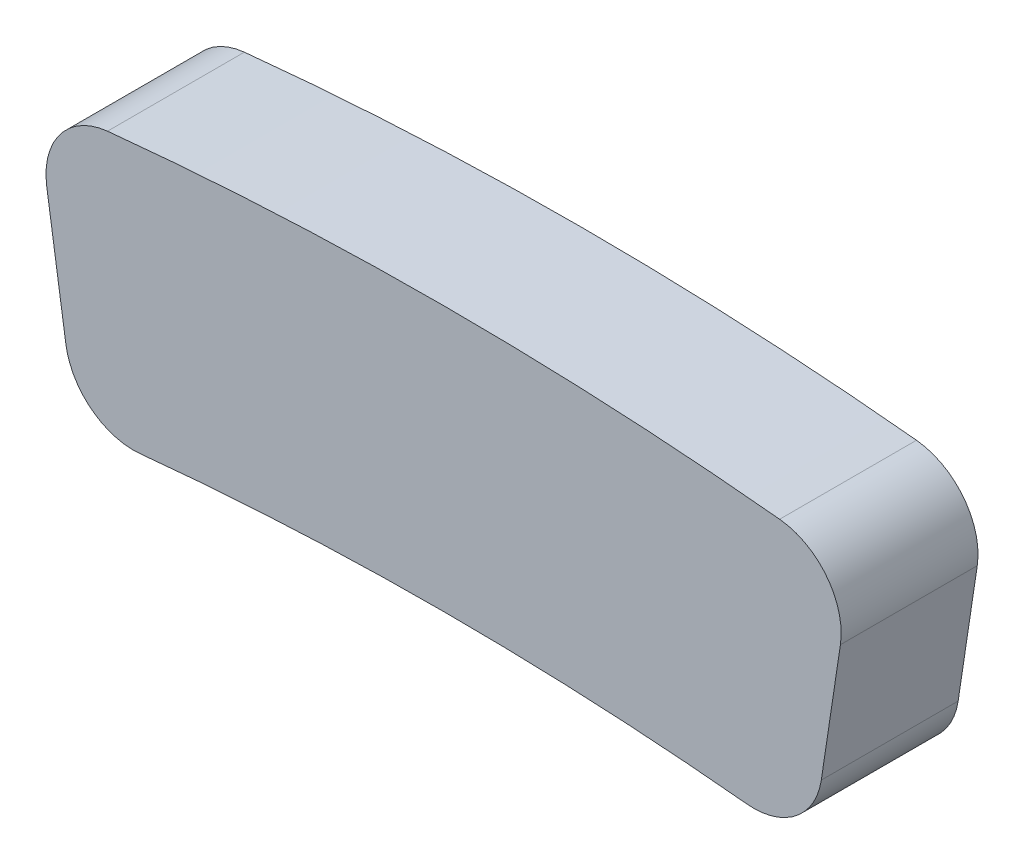
from build123d import *

# Parameters (mm, degrees)
BOSS_EXTRUDE1_DEPTH = 4
FILLET1_R           = 2


with BuildPart() as part:
    # Sketch1 → Boss-Extrude1 (new body)
    with BuildSketch(Plane.XY):
        with BuildLine():
            Line((-11.908609546, 96.641044089), (-10.753969279, 88.980506454))
            ThreePointArc((-10.753969279, 88.980506454), (0, 89.628), (10.753969279, 88.980506454))
            Line((10.753969279, 88.980506454), (11.908609546, 96.641044089))
            ThreePointArc((11.908609546, 96.641044089), (0, 97.372), (-11.908609546, 96.641044089))
        make_face()
    extrude(amount=BOSS_EXTRUDE1_DEPTH)

    # Fillet1
    fillet1_edges = [part.edges().sort_by_distance(p)[0] for p in [
        (11.908609546, 96.641044089, 2),
        (10.753969279, 88.980506454, 2),
        (-10.753969279, 88.980506454, 2),
        (-11.908609546, 96.641044089, 2),
    ]]
    fillet(fillet1_edges, radius=FILLET1_R)


solid = part.part
